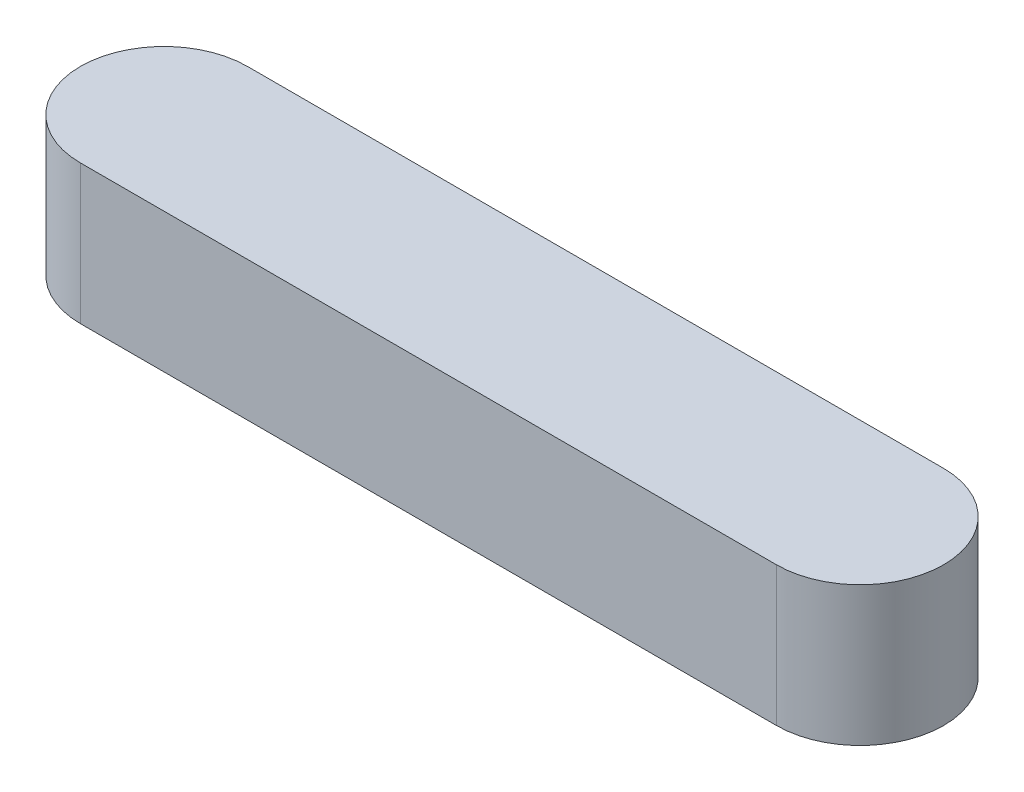
from build123d import *

# Parameters (mm, degrees)
BOSS_EXTRU_1_DEPTH = 5


with BuildPart() as part:
    # Esquisse1 → Boss.-Extru.1 (new body)
    with BuildSketch(Plane(origin=(0, 0, 0), x_dir=(1, 0, 0), z_dir=(0, 1, 0))):
        with BuildLine():
            Line((-21.178052638, -15.772859634), (-46.178052638, -15.772859634))
            ThreePointArc((-46.178052638, -15.772859634), (-49.178052638, -12.772859634), (-46.178052638, -9.772859634))
            Line((-46.178052638, -9.772859634), (-21.178052638, -9.772859634))
            ThreePointArc((-21.178052638, -9.772859634), (-18.178052638, -12.772859634), (-21.178052638, -15.772859634))
        make_face()
    extrude(amount=BOSS_EXTRU_1_DEPTH)


solid = part.part
